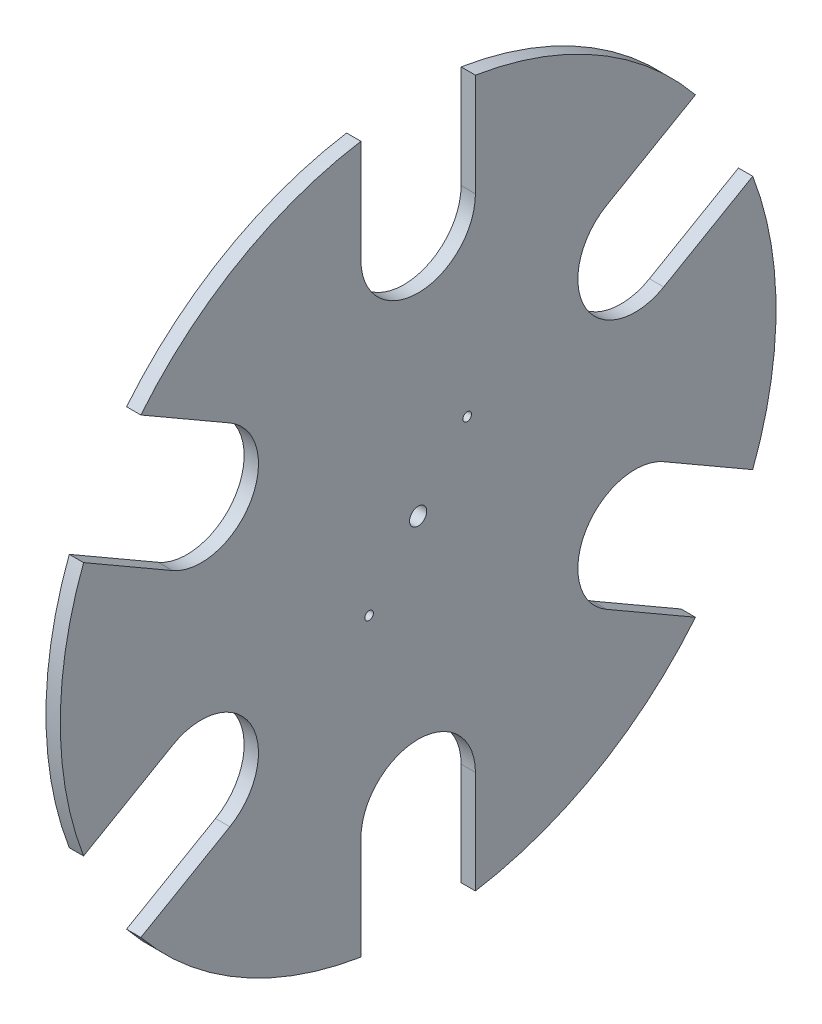
from build123d import *

# Parameters (mm, degrees)
SKETCH1_R               = 250
SKETCH1_R_2             = 6
SKETCH1_R_3             = 40
BOSS_EXTRUDE1_DEPTH     = 10
CUT_EXTRUDE1_DEPTH      = 354.694783677
CUT_EXTRUDE1_DEPTH_BACK = 354.694783677
SKETCH2_R               = 3


with BuildPart() as part:
    # Sketch1 → Boss-Extrude1 (new body)
    with BuildSketch(Plane(origin=(0, 0, 0), x_dir=(0, 0, -1), z_dir=(1, 0, 0))):
        Circle(SKETCH1_R)
        Circle(SKETCH1_R_2, mode=Mode.SUBTRACT)
        with Locations((0, 175)):
            Circle(SKETCH1_R_3, mode=Mode.SUBTRACT)
        with Locations((151.554445662, 87.5)):
            Circle(SKETCH1_R_3, mode=Mode.SUBTRACT)
        with Locations((151.554445662, -87.5)):
            Circle(SKETCH1_R_3, mode=Mode.SUBTRACT)
        with Locations((0, -175)):
            Circle(SKETCH1_R_3, mode=Mode.SUBTRACT)
        with Locations((-151.554445662, -87.5)):
            Circle(SKETCH1_R_3, mode=Mode.SUBTRACT)
        with Locations((-151.554445662, 87.5)):
            Circle(SKETCH1_R_3, mode=Mode.SUBTRACT)
    extrude(amount=BOSS_EXTRUDE1_DEPTH)

    # Sketch2 → Cut-Extrude1 (cut, two sides: drawn at the far end of the back side and taken through both)
    with BuildSketch(Plane.ZY.offset(-CUT_EXTRUDE1_DEPTH_BACK)):
        with Locations((-34.248705894, 43.035173342)):
            Circle(SKETCH2_R)
        with Locations((34.248705894, -43.035173342)):
            Circle(SKETCH2_R)
        with BuildLine():
            Line((-40, 175), (-40, 246.779253585))
            ThreePointArc((-40, 246.779253585), (0, 250), (40, 246.779253585))
            Line((40, 246.779253585), (40, 175))
            ThreePointArc((40, 175), (0, 215), (-40, 175))
        make_face()
        with BuildLine():
            Line((131.554445662, 122.141016151), (193.717102732, 158.030642944))
            ThreePointArc((193.717102732, 158.030642944), (216.506350946, 125), (233.717102732, 88.748610641))
            Line((233.717102732, 88.748610641), (171.554445662, 52.858983849))
            ThreePointArc((171.554445662, 52.858983849), (186.195461814, 107.5), (131.554445662, 122.141016151))
        make_face()
        with BuildLine():
            Line((171.554445662, -52.858983849), (233.717102732, -88.748610641))
            ThreePointArc((233.717102732, -88.748610641), (216.506350946, -125), (193.717102732, -158.030642944))
            Line((193.717102732, -158.030642944), (131.554445662, -122.141016151))
            ThreePointArc((131.554445662, -122.141016151), (186.195461814, -107.5), (171.554445662, -52.858983849))
        make_face()
        with BuildLine():
            Line((40, -175), (40, -246.779253585))
            ThreePointArc((40, -246.779253585), (0, -250), (-40, -246.779253585))
            Line((-40, -246.779253585), (-40, -175))
            ThreePointArc((-40, -175), (0, -215), (40, -175))
        make_face()
        with BuildLine():
            Line((-131.554445662, -122.141016151), (-193.717102732, -158.030642944))
            ThreePointArc((-193.717102732, -158.030642944), (-216.506350946, -125), (-233.717102732, -88.748610641))
            Line((-233.717102732, -88.748610641), (-171.554445662, -52.858983849))
            ThreePointArc((-171.554445662, -52.858983849), (-186.195461814, -107.5), (-131.554445662, -122.141016151))
        make_face()
        with BuildLine():
            Line((-171.554445662, 52.858983849), (-233.717102732, 88.748610641))
            ThreePointArc((-233.717102732, 88.748610641), (-216.506350946, 125), (-193.717102732, 158.030642944))
            Line((-193.717102732, 158.030642944), (-131.554445662, 122.141016151))
            ThreePointArc((-131.554445662, 122.141016151), (-186.195461814, 107.5), (-171.554445662, 52.858983849))
        make_face()
    extrude(amount=CUT_EXTRUDE1_DEPTH + CUT_EXTRUDE1_DEPTH_BACK, mode=Mode.SUBTRACT)


solid = part.part
